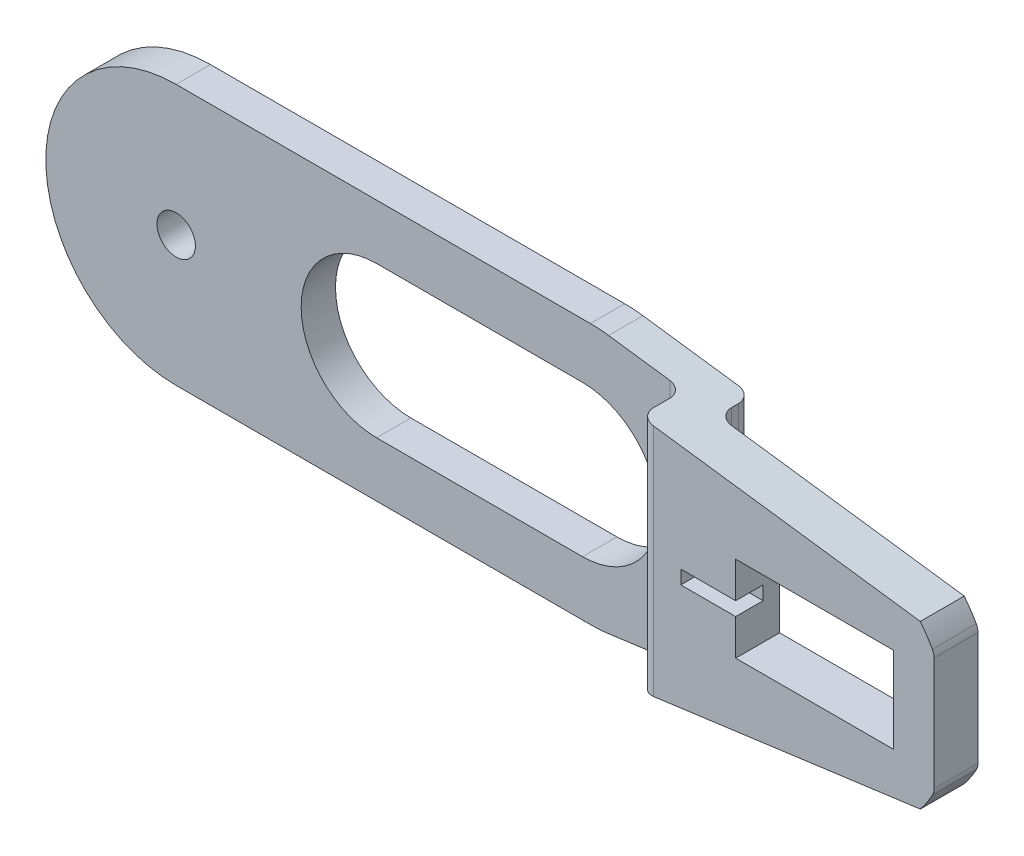
from build123d import *

# Parameters (mm, degrees)
SKETCH1_R           = 2.8
BOSS_EXTRUDE1_DEPTH = 5
FILLET1_R           = 2
BOSS_EXTRUDE2_DEPTH = 6.4
FILLET2_R           = 2
SKETCH3_W           = 8
SKETCH3_H           = 2
CUT_EXTRUDE1_DEPTH  = 4
SKETCH6_W           = 104.287250585
SKETCH6_H           = 38
CUT_EXTRUDE3_DEPTH  = 5
FILLET3_R           = 2
BOSS_EXTRUDE3_DEPTH = 6.4
CUT_EXTRUDE4_DEPTH  = 52
FILLET4_R           = 20


with BuildPart() as part:
    # Sketch1 → Boss-Extrude1 (new body)
    with BuildSketch(Plane.XY):
        with BuildLine():
            Line((0, 19), (100, 19))
            ThreePointArc((100, 19), (111.005680352, 15.487898502), (117.942616866, 6.25))
            Line((117.942616866, 6.25), (87.942616866, 6.25))
            Line((87.942616866, 6.25), (87.942616866, -6.25))
            Line((87.942616866, -6.25), (117.942616866, -6.25))
            ThreePointArc((117.942616866, -6.25), (111.005680352, -15.487898502), (100, -19))
            Line((100, -19), (0, -19))
            ThreePointArc((0, -19), (-19, 0), (0, 19))
        make_face()
        Circle(SKETCH1_R, mode=Mode.SUBTRACT)
        with BuildLine():
            Line((29.217733251, 11), (59.217733251, 11))
            ThreePointArc((59.217733251, 11), (70.217733251, 0), (59.217733251, -11))
            Line((59.217733251, -11), (29.217733251, -11))
            ThreePointArc((29.217733251, -11), (18.217733251, 0), (29.217733251, 11))
        make_face(mode=Mode.SUBTRACT)
    extrude(amount=BOSS_EXTRUDE1_DEPTH)

    # Fillet1
    fillet1_edges = [part.edges().sort_by_distance(p)[0] for p in [
        (117.942616866, 6.25, 2.5),
        (117.942616866, -6.25, 2.5),
    ]]
    fillet(fillet1_edges, radius=FILLET1_R)

    # Sketch2 → Boss-Extrude2 (add)
    with BuildSketch(Plane.XY.offset(5)):
        with BuildLine():
            Line((73.942616866, 19), (73.942616866, -19))
            Line((73.942616866, -19), (100, -19))
            ThreePointArc((100, -19), (109.638693468, -16.373624774), (116.612668437, -9.220588235))
            ThreePointArc((116.612668437, -9.220588235), (116.587505946, -7.235400688), (114.863966496, -6.25))
            Line((114.863966496, -6.25), (87.942616866, -6.25))
            Line((87.942616866, -6.25), (87.942616866, 6.25))
            Line((87.942616866, 6.25), (114.863966496, 6.25))
            ThreePointArc((114.863966496, 6.25), (116.587505946, 7.235400688), (116.612668437, 9.220588235))
            ThreePointArc((116.612668437, 9.220588235), (109.638693468, 16.373624774), (100, 19))
            Line((100, 19), (73.942616866, 19))
        make_face()
    extrude(amount=BOSS_EXTRUDE2_DEPTH)

    # Fillet2
    fillet2_edges = [part.edges().sort_by_distance(p)[0] for p in [
        (73.942616866, 0, 5),
        (73.942616866, 0, 11.4),
    ]]
    fillet(fillet2_edges, radius=FILLET2_R)

    # Sketch3 → Cut-Extrude1 (cut)
    with BuildSketch(Plane.XY.offset(11.4)):
        with Locations((83.942616866, 0)):
            Rectangle(SKETCH3_W, SKETCH3_H)
    extrude(amount=-CUT_EXTRUDE1_DEPTH, mode=Mode.SUBTRACT)

    # Sketch6 → Cut-Extrude3 (cut)
    with BuildSketch(Plane(origin=(0, 0, 0), x_dir=(-1, 0, 0), z_dir=(0, 0, -1))):
        with Locations((-131.086242158, 0)):
            Rectangle(SKETCH6_W, SKETCH6_H)
    extrude(amount=-CUT_EXTRUDE3_DEPTH, mode=Mode.SUBTRACT)

    # Fillet3
    fillet3_edges = [part.edges().sort_by_distance(p)[0] for p in [
        (78.942616866, 0, 0),
        (78.942616866, 0, 5),
    ]]
    fillet(fillet3_edges, radius=FILLET3_R)

    # Sketch7 → Boss-Extrude3 (add)
    with BuildSketch(Plane.XY.offset(11.4)):
        with BuildLine():
            Line((114.863966496, 6.25), (110.942616866, 6.25))
            Line((110.942616866, 6.25), (110.942616866, -6.25))
            Line((110.942616866, -6.25), (114.863966496, -6.25))
            ThreePointArc((114.863966496, -6.25), (116.278180059, -6.835786438), (116.863966496, -8.25))
            Line((116.863966496, -8.25), (116.863966496, 8.25))
            ThreePointArc((116.863966496, 8.25), (116.278180059, 6.835786438), (114.863966496, 6.25))
        make_face()
    extrude(amount=-BOSS_EXTRUDE3_DEPTH)

    # Sketch8 → Cut-Extrude4 (cut)
    with BuildSketch(Plane.XY.offset(11.4)):
        Polygon((49.166460224, 20.686961638), (202.884451104, 0), (49.166460224, -20.686961638), (49.166460224, -34.841866296), (221.786697366, -38.976706561), (223.885725762, 48.652985565), (49.166460224, 52.838104681), (49.166460224, 51.155729305), align=None)
    extrude(amount=-CUT_EXTRUDE4_DEPTH, mode=Mode.SUBTRACT)

    # Fillet4
    fillet4_edges = [part.edges().sort_by_distance(p)[0] for p in [
        (61.701715921, -19, 2.5),
        (61.701715921, 19, 2.5),
    ]]
    fillet(fillet4_edges, radius=FILLET4_R)


solid = part.part
